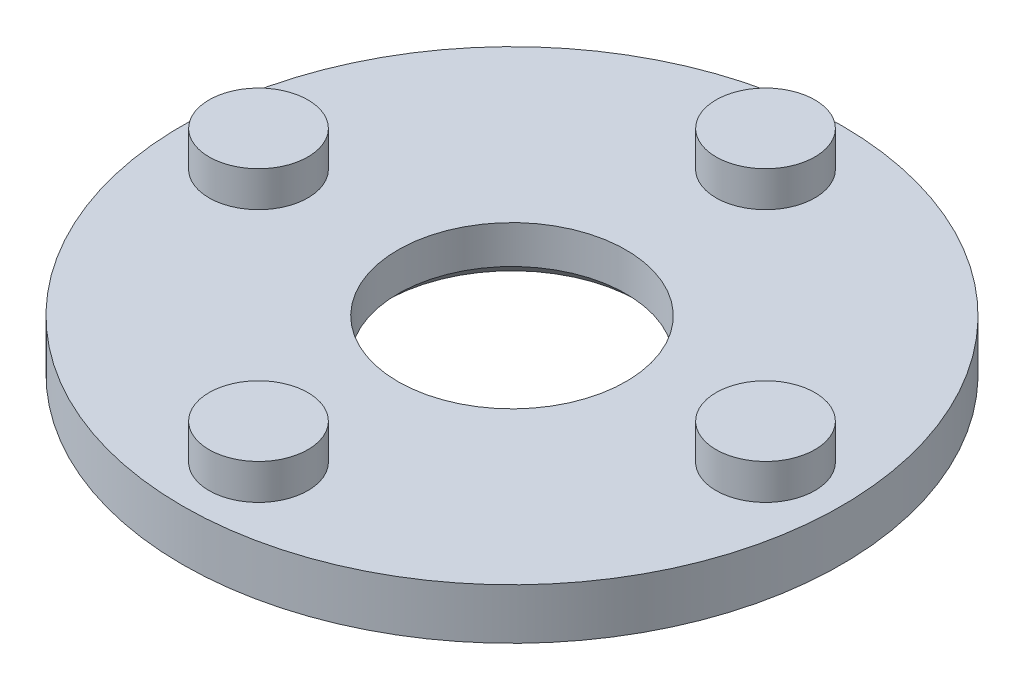
from build123d import *

# Parameters (mm, degrees)
SKETCH1_R           = 13
BOSS_EXTRUDE1_DEPTH = 2
SKETCH2_R           = 4.5
CUT_EXTRUDE1_DEPTH  = 19.493242009
SKETCH3_R           = 1.95
BOSS_EXTRUDE2_DEPTH = 1.4
CHAMFER1_SIZE       = 0.5


with BuildPart() as part:
    # Sketch1 → Boss-Extrude1 (new body)
    with BuildSketch(Plane(origin=(0, 0, 0), x_dir=(1, 0, 0), z_dir=(0, 1, 0))):
        with Locations(Location((0, 0, 0), (0, 0, 270))):
            Circle(SKETCH1_R)
    extrude(amount=BOSS_EXTRUDE1_DEPTH)

    # Sketch2 → Cut-Extrude1 (cut, through all)
    with BuildSketch(Plane(origin=(0, 2, 0), x_dir=(1, 0, 0), z_dir=(0, 1, 0))):
        with Locations(Location((0, 0, 0), (0, 0, 270))):
            Circle(SKETCH2_R)
    extrude(amount=-CUT_EXTRUDE1_DEPTH, mode=Mode.SUBTRACT)

    # Sketch3 → Boss-Extrude2 (add)
    with BuildSketch(Plane(origin=(0, 2, 0), x_dir=(1, 0, 0), z_dir=(0, 1, 0))):
        with Locations(Location((0, 10, 0), (0, 0, 270))):
            Circle(SKETCH3_R)
        with Locations(Location((10, 0, 0), (0, 0, 270))):
            Circle(SKETCH3_R)
        with Locations(Location((-10, 0, 0), (0, 0, 270))):
            Circle(SKETCH3_R)
        with Locations(Location((0, -10, 0), (0, 0, 270))):
            Circle(SKETCH3_R)
    extrude(amount=BOSS_EXTRUDE2_DEPTH)

    # Chamfer1
    chamfer1_edges = [part.edges().sort_by_distance(p)[0] for p in [
        (0, 0, -4.5),
    ]]
    chamfer(chamfer1_edges, length=CHAMFER1_SIZE)


solid = part.part
